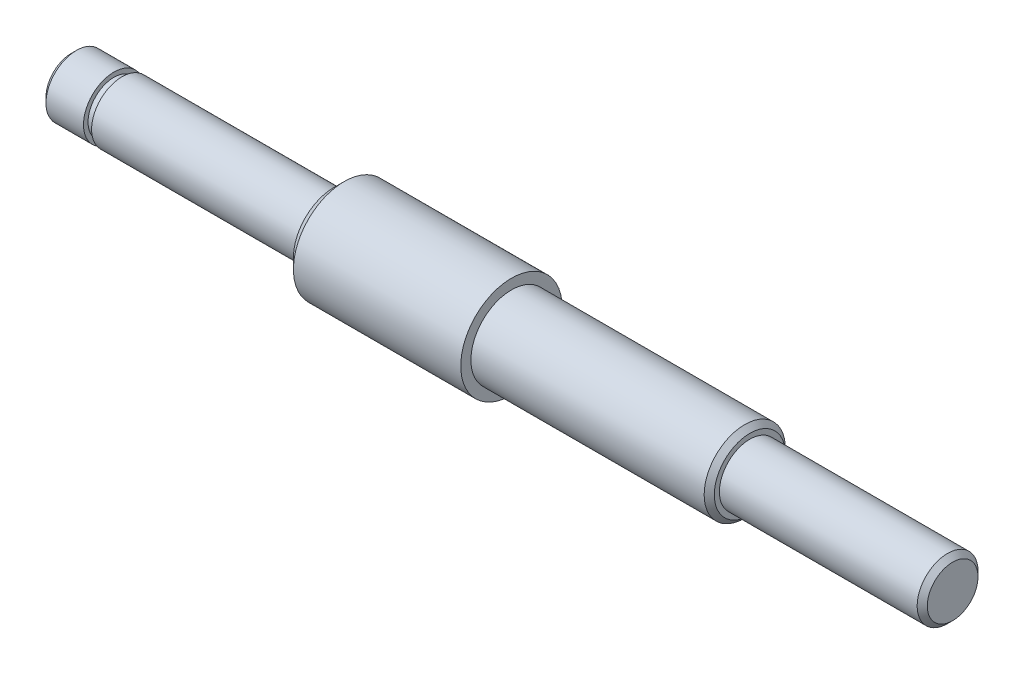
from build123d import *

# Parameters (mm, degrees)
CHAFL_N1_SIZE = 0.5
CHAFL_N2_SIZE = 1


with BuildPart() as part:
    # Croquis1 → Revolución1 (revolve)
    with BuildSketch(Plane(origin=(0, 0, 0), x_dir=(-1, 0, 0), z_dir=(0, 1, 0)), mode=Mode.PRIVATE) as revoluci_n1_sk:
        Polygon((-43.45, 0), (-43.45, 3), (-23.45, 3), (-23.45, 4), (0.05, 4), (0.05, 5), (17.55, 5), (17.55, 3), (38.45, 3), (38.45, 2.55), (39.25, 2.55), (39.25, 3), (43.45, 3), (43.45, 0), align=None)
    revolve(revoluci_n1_sk.sketch.rotate(Axis((43.45, 0, 0), (-1, 0, 0)), 180), axis=Axis((43.45, 0, 0), (-1, 0, 0)))

    # Chaflán1
    chafl_n1_edges = [part.edges().sort_by_distance(p)[0] for p in [
        (-43.45, 0, 3),
        (23.45, 0, 4),
        (43.45, 0, 3),
    ]]
    chamfer(chafl_n1_edges, length=CHAFL_N1_SIZE)

    # Chaflán2
    chafl_n2_edges = [part.edges().sort_by_distance(p)[0] for p in [
        (-17.55, 0, 5),
    ]]
    chamfer(chafl_n2_edges, length=CHAFL_N2_SIZE)


solid = part.part
